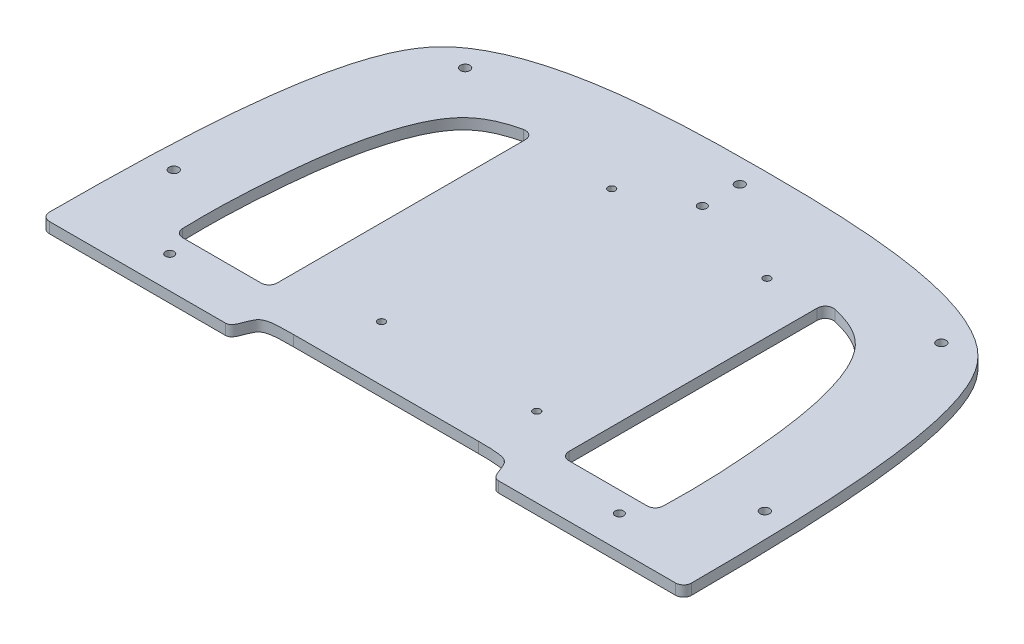
from build123d import *

# Parameters (mm, degrees)
SKETCH1_W           = 240
SKETCH1_H           = 310
BOSS_EXTRUDE1_DEPTH = 4
CUT_EXTRUDE1_REACH  = 198.064
SKETCH2_R           = 1.75
CUT_EXTRUDE2_REACH  = 198.064
SKETCH3_R           = 1.75
FILLET3_R           = 3
CUT_EXTRUDE3_REACH  = 198.058
SKETCH4_R           = 1.35
CUT_EXTRUDE5_DEPTH  = 10
SKETCH7_R           = 1.6
CUT_EXTRUDE6_DEPTH  = 197.058343884


with BuildPart() as part:
    # Sketch1 → Boss-Extrude1 (new body)
    with BuildSketch(Plane(origin=(0, 0, 0), x_dir=(1, 0, 0), z_dir=(0, 1, 0))):
        Rectangle(SKETCH1_W, SKETCH1_H)
    extrude(amount=BOSS_EXTRUDE1_DEPTH)

    # Sketch2 → Cut-Extrude1 (cut, up to next)
    with BuildSketch(Plane(origin=(0, 4, 0), x_dir=(1, 0, 0), z_dir=(0, 1, 0)), mode=Mode.PRIVATE) as cut_extrude1_sk1:
        with BuildLine():
            Line((-120, 155), (-120, 0))
            add(Edge.make_bspline(
                [(0, 155), (-30.572222193, 155), (-80.343316982, 153.733320995), (-119.221157946, 117.654395612), (-120, 45.41001223), (-120, 0)],
                knots=[0, 0, 0, 0, 0.458017491, 0.558017491, 1, 1, 1, 1], degree=3))
            Line((0, 155), (-120, 155))
        make_face()
    cut_extrude1_tool1 = extrude(cut_extrude1_sk1.sketch, amount=-CUT_EXTRUDE1_REACH, mode=Mode.PRIVATE) & part.part
    # Sketch2 → Cut-Extrude1 (cut, up to next)
    with BuildSketch(Plane(origin=(0, 4, 0), x_dir=(1, 0, 0), z_dir=(0, 1, 0)), mode=Mode.PRIVATE) as cut_extrude1_sk2:
        with BuildLine():
            add(Edge.make_bspline(
                [(0, 155), (30.572222193, 155), (80.343316982, 153.733320995), (119.221157946, 117.654395612), (120, 45.41001223), (120, 0)],
                knots=[0, 0, 0, 0, 0.458017491, 0.558017491, 1, 1, 1, 1], degree=3))
            Line((120, 0), (120, 155))
            Line((120, 155), (0, 155))
        make_face()
    cut_extrude1_tool2 = extrude(cut_extrude1_sk2.sketch, amount=-CUT_EXTRUDE1_REACH, mode=Mode.PRIVATE) & part.part
    # Sketch2 → Cut-Extrude1 (cut, up to next)
    with BuildSketch(Plane(origin=(0, 4, 0), x_dir=(1, 0, 0), z_dir=(0, 1, 0)), mode=Mode.PRIVATE) as cut_extrude1_sk3:
        with BuildLine():
            Line((120, -155), (120, 0))
            add(Edge.make_bspline(
                [(0, -155), (30.572222193, -155), (80.343316982, -153.733320995), (119.221157946, -117.654395612), (120, -45.41001223), (120, 0)],
                knots=[0, 0, 0, 0, 0.458017491, 0.558017491, 1, 1, 1, 1], degree=3))
            Line((0, -155), (120, -155))
        make_face()
    cut_extrude1_tool3 = extrude(cut_extrude1_sk3.sketch, amount=-CUT_EXTRUDE1_REACH, mode=Mode.PRIVATE) & part.part
    # Sketch2 → Cut-Extrude1 (cut, up to next)
    with BuildSketch(Plane(origin=(0, 4, 0), x_dir=(1, 0, 0), z_dir=(0, 1, 0)), mode=Mode.PRIVATE) as cut_extrude1_sk4:
        with BuildLine():
            add(Edge.make_bspline(
                [(0, -155), (-30.572222193, -155), (-80.343316982, -153.733320995), (-119.221157946, -117.654395612), (-120, -45.41001223), (-120, 0)],
                knots=[0, 0, 0, 0, 0.458017491, 0.558017491, 1, 1, 1, 1], degree=3))
            Line((-120, 0), (-120, -155))
            Line((-120, -155), (0, -155))
        make_face()
    cut_extrude1_tool4 = extrude(cut_extrude1_sk4.sketch, amount=-CUT_EXTRUDE1_REACH, mode=Mode.PRIVATE) & part.part
    # Sketch2 → Cut-Extrude1 (cut, up to next)
    with BuildSketch(Plane(origin=(0, 4, 0), x_dir=(1, 0, 0), z_dir=(0, 1, 0)), mode=Mode.PRIVATE) as cut_extrude1_sk5:
        with Locations(Location((-88.957037006, 132.338171163, 0), (0, 0, 270))):
            Circle(SKETCH2_R)
    cut_extrude1_tool5 = extrude(cut_extrude1_sk5.sketch, amount=-CUT_EXTRUDE1_REACH, mode=Mode.PRIVATE) & part.part
    # Sketch2 → Cut-Extrude1 (cut, up to next)
    with BuildSketch(Plane(origin=(0, 4, 0), x_dir=(1, 0, 0), z_dir=(0, 1, 0)), mode=Mode.PRIVATE) as cut_extrude1_sk6:
        with Locations(Location((0, 146, 0), (0, 0, 270))):
            Circle(SKETCH2_R)
    cut_extrude1_tool6 = extrude(cut_extrude1_sk6.sketch, amount=-CUT_EXTRUDE1_REACH, mode=Mode.PRIVATE) & part.part
    # Sketch2 → Cut-Extrude1 (cut, up to next)
    with BuildSketch(Plane(origin=(0, 4, 0), x_dir=(1, 0, 0), z_dir=(0, 1, 0)), mode=Mode.PRIVATE) as cut_extrude1_sk7:
        with Locations(Location((88.957037006, 132.338171163, 0), (0, 0, 270))):
            Circle(SKETCH2_R)
    cut_extrude1_tool7 = extrude(cut_extrude1_sk7.sketch, amount=-CUT_EXTRUDE1_REACH, mode=Mode.PRIVATE) & part.part
    # Sketch2 → Cut-Extrude1 (cut, up to next)
    with BuildSketch(Plane(origin=(0, 4, 0), x_dir=(1, 0, 0), z_dir=(0, 1, 0)), mode=Mode.PRIVATE) as cut_extrude1_sk8:
        with Locations(Location((-110.418476952, 44.934472183, 0), (0, 0, 270))):
            Circle(SKETCH2_R)
    cut_extrude1_tool8 = extrude(cut_extrude1_sk8.sketch, amount=-CUT_EXTRUDE1_REACH, mode=Mode.PRIVATE) & part.part
    # Sketch2 → Cut-Extrude1 (cut, up to next)
    with BuildSketch(Plane(origin=(0, 4, 0), x_dir=(1, 0, 0), z_dir=(0, 1, 0)), mode=Mode.PRIVATE) as cut_extrude1_sk9:
        with Locations(Location((-49, -30, 0), (0, 0, 270))):
            Circle(SKETCH2_R)
    cut_extrude1_tool9 = extrude(cut_extrude1_sk9.sketch, amount=-CUT_EXTRUDE1_REACH, mode=Mode.PRIVATE) & part.part
    # Sketch2 → Cut-Extrude1 (cut, up to next)
    with BuildSketch(Plane(origin=(0, 4, 0), x_dir=(1, 0, 0), z_dir=(0, 1, 0)), mode=Mode.PRIVATE) as cut_extrude1_sk10:
        with Locations(Location((49, -30, 0), (0, 0, 270))):
            Circle(SKETCH2_R)
    cut_extrude1_tool10 = extrude(cut_extrude1_sk10.sketch, amount=-CUT_EXTRUDE1_REACH, mode=Mode.PRIVATE) & part.part
    # Sketch2 → Cut-Extrude1 (cut, up to next)
    with BuildSketch(Plane(origin=(0, 4, 0), x_dir=(1, 0, 0), z_dir=(0, 1, 0)), mode=Mode.PRIVATE) as cut_extrude1_sk11:
        with Locations(Location((-88.957037006, -132.338171163, 0), (0, 0, 270))):
            Circle(SKETCH2_R)
    cut_extrude1_tool11 = extrude(cut_extrude1_sk11.sketch, amount=-CUT_EXTRUDE1_REACH, mode=Mode.PRIVATE) & part.part
    # Sketch2 → Cut-Extrude1 (cut, up to next)
    with BuildSketch(Plane(origin=(0, 4, 0), x_dir=(1, 0, 0), z_dir=(0, 1, 0)), mode=Mode.PRIVATE) as cut_extrude1_sk12:
        with Locations(Location((0, -146, 0), (0, 0, 270))):
            Circle(SKETCH2_R)
    cut_extrude1_tool12 = extrude(cut_extrude1_sk12.sketch, amount=-CUT_EXTRUDE1_REACH, mode=Mode.PRIVATE) & part.part
    # Sketch2 → Cut-Extrude1 (cut, up to next)
    with BuildSketch(Plane(origin=(0, 4, 0), x_dir=(1, 0, 0), z_dir=(0, 1, 0)), mode=Mode.PRIVATE) as cut_extrude1_sk13:
        with Locations(Location((88.957037006, -132.338171163, 0), (0, 0, 270))):
            Circle(SKETCH2_R)
    cut_extrude1_tool13 = extrude(cut_extrude1_sk13.sketch, amount=-CUT_EXTRUDE1_REACH, mode=Mode.PRIVATE) & part.part
    # Sketch2 → Cut-Extrude1 (cut, up to next)
    with BuildSketch(Plane(origin=(0, 4, 0), x_dir=(1, 0, 0), z_dir=(0, 1, 0)), mode=Mode.PRIVATE) as cut_extrude1_sk14:
        with Locations(Location((110.418476952, 44.934472183, 0), (0, 0, 270))):
            Circle(SKETCH2_R)
    cut_extrude1_tool14 = extrude(cut_extrude1_sk14.sketch, amount=-CUT_EXTRUDE1_REACH, mode=Mode.PRIVATE) & part.part
    add(cut_extrude1_tool1.solids().sort_by_distance((-102.173006, 4, -133.115769))[0], mode=Mode.SUBTRACT)
    add(cut_extrude1_tool2.solids().sort_by_distance((102.087926, 4, -133.133004))[0], mode=Mode.SUBTRACT)
    add(cut_extrude1_tool3.solids().sort_by_distance((102.087926, 4, 133.133004))[0], mode=Mode.SUBTRACT)
    add(cut_extrude1_tool4.solids().sort_by_distance((-102.173006, 4, 133.115769))[0], mode=Mode.SUBTRACT)
    add(cut_extrude1_tool5.solids().sort_by_distance((-88.957037, 4, -132.338171))[0], mode=Mode.SUBTRACT)
    add(cut_extrude1_tool6.solids().sort_by_distance((0, 4, -146))[0], mode=Mode.SUBTRACT)
    add(cut_extrude1_tool7.solids().sort_by_distance((88.957037, 4, -132.338171))[0], mode=Mode.SUBTRACT)
    add(cut_extrude1_tool8.solids().sort_by_distance((-110.418477, 4, -44.934472))[0], mode=Mode.SUBTRACT)
    add(cut_extrude1_tool9.solids().sort_by_distance((-49, 4, 30))[0], mode=Mode.SUBTRACT)
    add(cut_extrude1_tool10.solids().sort_by_distance((49, 4, 30))[0], mode=Mode.SUBTRACT)
    add(cut_extrude1_tool11.solids().sort_by_distance((-88.957037, 4, 132.338171))[0], mode=Mode.SUBTRACT)
    add(cut_extrude1_tool12.solids().sort_by_distance((0, 4, 146))[0], mode=Mode.SUBTRACT)
    add(cut_extrude1_tool13.solids().sort_by_distance((88.957037, 4, 132.338171))[0], mode=Mode.SUBTRACT)
    add(cut_extrude1_tool14.solids().sort_by_distance((110.418477, 4, -44.934472))[0], mode=Mode.SUBTRACT)

    # Sketch3 → Cut-Extrude2 (cut, up to next)
    with BuildSketch(Plane(origin=(0, 4, 0), x_dir=(1, 0, 0), z_dir=(0, 1, 0)), mode=Mode.PRIVATE) as cut_extrude2_sk1:
        with BuildLine():
            Line((-120, 0), (120, 0))
            add(Edge.make_bspline(
                [(0, -155), (30.572222193, -155), (80.343316982, -153.733320995), (119.221157946, -117.654395612), (120, -45.41001223), (120, 0)],
                knots=[0, 0, 0, 0, 0.458017491, 0.558017491, 1, 1, 1, 1], degree=3))
            add(Edge.make_bspline(
                [(-120, 0), (-120, -45.41001223), (-119.221157946, -117.654395612), (-80.343316982, -153.733320995), (-30.572222193, -155), (0, -155)],
                knots=[0, 0, 0, 0, 0.441982509, 0.541982509, 1, 1, 1, 1], degree=3))
        make_face()
        with Locations((88.957037006, -132.338171163)):
            Circle(SKETCH3_R, mode=Mode.SUBTRACT)
        with Locations((49, -30)):
            Circle(SKETCH3_R, mode=Mode.SUBTRACT)
        with Locations((-88.957037006, -132.338171163)):
            Circle(SKETCH3_R, mode=Mode.SUBTRACT)
        with Locations((-49, -30)):
            Circle(SKETCH3_R, mode=Mode.SUBTRACT)
        with Locations((0, -146)):
            Circle(SKETCH3_R, mode=Mode.SUBTRACT)
    cut_extrude2_tool1 = extrude(cut_extrude2_sk1.sketch, amount=-CUT_EXTRUDE2_REACH, mode=Mode.PRIVATE) & part.part
    # Sketch3 → Cut-Extrude2 (cut, up to next)
    with BuildSketch(Plane(origin=(0, 4, 0), x_dir=(1, 0, 0), z_dir=(0, 1, 0)), mode=Mode.PRIVATE) as cut_extrude2_sk2:
        with BuildLine():
            add(Edge.make_bspline(
                [(-119.996868981, 5), (-119.999161826, 3.317063079), (-120, 1.649620662), (-120, 0)],
                knots=[0.983943993, 0.983943993, 0.983943993, 0.983943993, 1, 1, 1, 1], degree=3))
            Line((-120, 0), (120, 0))
            add(Edge.make_bspline(
                [(120, 0), (120, 1.649620662), (119.999161826, 3.317063079), (119.996868981, 5)],
                knots=[0, 0, 0, 0, 0.016056007, 0.016056007, 0.016056007, 0.016056007], degree=3))
            Line((119.996868981, 5), (-119.996868981, 5))
        make_face()
    cut_extrude2_tool2 = extrude(cut_extrude2_sk2.sketch, amount=-CUT_EXTRUDE2_REACH, mode=Mode.PRIVATE) & part.part
    add(cut_extrude2_tool1.solids().sort_by_distance((0, 4, 73.058016))[0], mode=Mode.SUBTRACT)
    add(cut_extrude2_tool2.solids().sort_by_distance((0, 4, -2.499989))[0], mode=Mode.SUBTRACT)

    # Fillet3
    fillet3_edges = [part.edges().sort_by_distance(p)[0] for p in [
        (119.996868981, 2, -5),
        (-119.996868981, 2, -5),
    ]]
    fillet(fillet3_edges, radius=FILLET3_R)

    # Sketch4 → Cut-Extrude3 (cut, up to next)
    with BuildSketch(Plane(origin=(0, 4, 0), x_dir=(1, 0, 0), z_dir=(0, 1, 0)), mode=Mode.PRIVATE) as cut_extrude3_sk1:
        with Locations(Location((35.5, 120.625, 0), (0, 0, 270))):
            Circle(SKETCH4_R)
    cut_extrude3_tool1 = extrude(cut_extrude3_sk1.sketch, amount=-CUT_EXTRUDE3_REACH, mode=Mode.PRIVATE) & part.part
    # Sketch4 → Cut-Extrude3 (cut, up to next)
    with BuildSketch(Plane(origin=(0, 4, 0), x_dir=(1, 0, 0), z_dir=(0, 1, 0)), mode=Mode.PRIVATE) as cut_extrude3_sk2:
        with Locations(Location((-22.5, 120.625, 0), (0, 0, 270))):
            Circle(SKETCH4_R)
    cut_extrude3_tool2 = extrude(cut_extrude3_sk2.sketch, amount=-CUT_EXTRUDE3_REACH, mode=Mode.PRIVATE) & part.part
    # Sketch4 → Cut-Extrude3 (cut, up to next)
    with BuildSketch(Plane(origin=(0, 4, 0), x_dir=(1, 0, 0), z_dir=(0, 1, 0)), mode=Mode.PRIVATE) as cut_extrude3_sk3:
        with Locations(Location((-22.5, 34.625, 0), (0, 0, 270))):
            Circle(SKETCH4_R)
    cut_extrude3_tool3 = extrude(cut_extrude3_sk3.sketch, amount=-CUT_EXTRUDE3_REACH, mode=Mode.PRIVATE) & part.part
    # Sketch4 → Cut-Extrude3 (cut, up to next)
    with BuildSketch(Plane(origin=(0, 4, 0), x_dir=(1, 0, 0), z_dir=(0, 1, 0)), mode=Mode.PRIVATE) as cut_extrude3_sk4:
        with Locations(Location((35.5, 34.625, 0), (0, 0, 270))):
            Circle(SKETCH4_R)
    cut_extrude3_tool4 = extrude(cut_extrude3_sk4.sketch, amount=-CUT_EXTRUDE3_REACH, mode=Mode.PRIVATE) & part.part
    # Sketch4 → Cut-Extrude3 (cut, up to next)
    with BuildSketch(Plane(origin=(0, 4, 0), x_dir=(1, 0, 0), z_dir=(0, 1, 0)), mode=Mode.PRIVATE) as cut_extrude3_sk5:
        with BuildLine():
            Line((-54.5, 120.414996484), (-54.5, 27.625))
            ThreePointArc((-54.5, 27.625), (-55.378679656, 25.503679656), (-57.5, 24.625))
            Line((-57.5, 24.625), (-86.788971681, 24.625))
            ThreePointArc((-86.788971681, 24.625), (-88.879047631, 25.472888822), (-89.787688891, 27.537278318))
            add(Edge.make_bspline(
                [(-58.163673204, 123.340665275), (-67.240865223, 121.281550065), (-77.02174129, 114.714965076), (-85.211622847, 91.893773174), (-89.065552726, 63.364673665), (-90.198332961, 41.574918914), (-89.787688891, 27.537278318)],
                knots=[0.021021286, 0.021021286, 0.021021286, 0.021021286, 0.204023658, 0.379970554, 0.619260727, 0.97438654, 0.97438654, 0.97438654, 0.97438654], degree=3))
            ThreePointArc((-58.163673204, 123.340665275), (-55.627971636, 122.759246856), (-54.5, 120.414996484))
        make_face()
    cut_extrude3_tool5 = extrude(cut_extrude3_sk5.sketch, amount=-CUT_EXTRUDE3_REACH, mode=Mode.PRIVATE) & part.part
    # Sketch4 → Cut-Extrude3 (cut, up to next)
    with BuildSketch(Plane(origin=(0, 4, 0), x_dir=(1, 0, 0), z_dir=(0, 1, 0)), mode=Mode.PRIVATE) as cut_extrude3_sk6:
        with BuildLine():
            Line((54.5, 120.414996484), (54.5, 27.625))
            ThreePointArc((54.5, 27.625), (55.378679656, 25.503679656), (57.5, 24.625))
            Line((57.5, 24.625), (86.788971681, 24.625))
            ThreePointArc((86.788971681, 24.625), (88.879047631, 25.472888822), (89.787688891, 27.537278318))
            add(Edge.make_bspline(
                [(58.163673204, 123.340665275), (67.240865223, 121.281550065), (77.02174129, 114.714965076), (85.211622847, 91.893773174), (89.065552726, 63.364673665), (90.198332961, 41.574918914), (89.787688891, 27.537278318)],
                knots=[0.021021286, 0.021021286, 0.021021286, 0.021021286, 0.204023658, 0.379970554, 0.619260727, 0.97438654, 0.97438654, 0.97438654, 0.97438654], degree=3))
            ThreePointArc((58.163673204, 123.340665275), (55.627971636, 122.759246856), (54.5, 120.414996484))
        make_face()
    cut_extrude3_tool6 = extrude(cut_extrude3_sk6.sketch, amount=-CUT_EXTRUDE3_REACH, mode=Mode.PRIVATE) & part.part
    add(cut_extrude3_tool1.solids().sort_by_distance((35.5, 4, -120.625))[0], mode=Mode.SUBTRACT)
    add(cut_extrude3_tool2.solids().sort_by_distance((-22.5, 4, -120.625))[0], mode=Mode.SUBTRACT)
    add(cut_extrude3_tool3.solids().sort_by_distance((-22.5, 4, -34.625))[0], mode=Mode.SUBTRACT)
    add(cut_extrude3_tool4.solids().sort_by_distance((35.5, 4, -34.625))[0], mode=Mode.SUBTRACT)
    add(cut_extrude3_tool5.solids().sort_by_distance((-70.353958, 4, -68.800646))[0], mode=Mode.SUBTRACT)
    add(cut_extrude3_tool6.solids().sort_by_distance((70.353958, 4, -68.800646))[0], mode=Mode.SUBTRACT)

    # Sketch6 → Cut-Extrude5 (cut)
    with BuildSketch(Plane(origin=(0, 4, 0), x_dir=(1, 0, 0), z_dir=(0, 1, 0))):
        with BuildLine():
            Line((50.830198422, 5), (-51.169801578, 5))
            add(Edge.make_bspline(
                [(-51.169801578, 5), (-49.299436936, 5), (-47.738812657, 9.603739303), (-47.546189213, 9.777303645), (-45.710508099, 13.740967427), (-41.852367998, 14.036563826), (-34.712379289, 14.036563826)],
                knots=[0, 0, 0, 0, 0.228374011, 0.487299701, 0.5644623, 1, 1, 1, 1], degree=3))
            Line((-34.712379289, 14.036563826), (34.372776133, 14.036563826))
            add(Edge.make_bspline(
                [(50.830198422, 5), (48.95983378, 5), (47.3992095, 9.603739303), (47.206586056, 9.777303645), (45.370904943, 13.740967427), (41.512764842, 14.036563826), (34.372776133, 14.036563826)],
                knots=[0, 0, 0, 0, 0.228374011, 0.487299701, 0.5644623, 1, 1, 1, 1], degree=3))
        make_face()
    extrude(amount=-CUT_EXTRUDE5_DEPTH, mode=Mode.SUBTRACT)

    # Sketch7 → Cut-Extrude6 (cut, through all)
    with BuildSketch(Plane(origin=(0, 4, 0), x_dir=(1, 0, 0), z_dir=(0, 1, 0))):
        with Locations(Location((0, 132, 0), (0, 0, 270))):
            Circle(SKETCH7_R)
        with Locations(Location((-84, 17, 0), (0, 0, 270))):
            Circle(SKETCH7_R)
        with Locations(Location((84, 17, 0), (0, 0, 270))):
            Circle(SKETCH7_R)
    extrude(amount=-CUT_EXTRUDE6_DEPTH, mode=Mode.SUBTRACT)


solid = part.part
